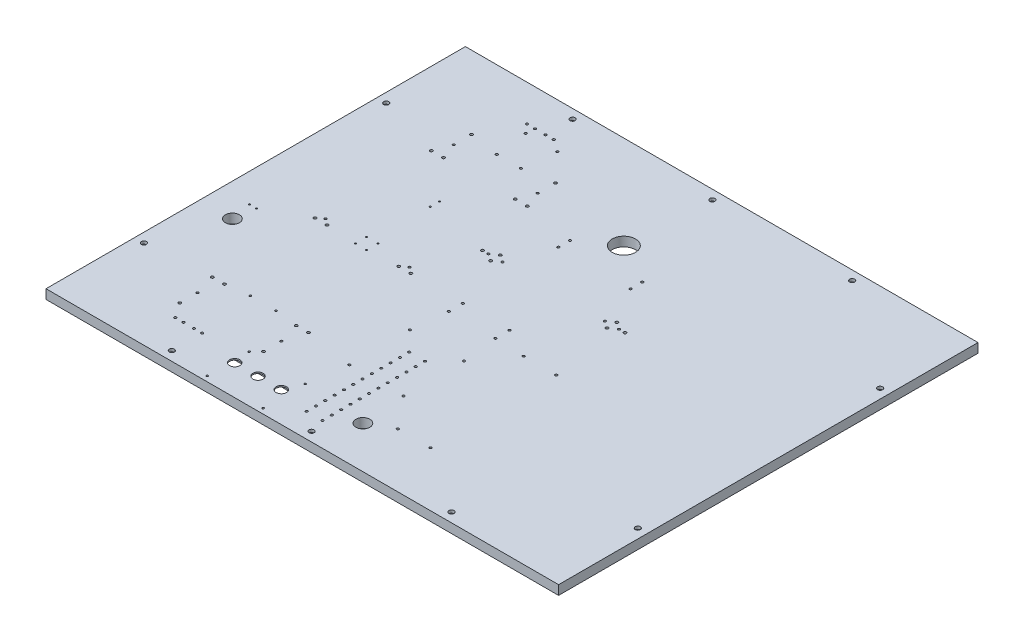
from build123d import *

# Parameters (mm, degrees)
SKETCH_1_W                   = 1100
SKETCH_1_H                   = 900
EXTRUDE_1_DEPTH              = 20
HOLE_WIZARD_M6_1_D           = 7
HOLE_WIZARD_M6_1_CBORE_D     = 11
HOLE_WIZARD_M6_1_CBORE_DEPTH = 6
HOLE_WIZARD_M4_1_D           = 3.3
HOLE_WIZARD_M4_1_DEPTH       = 10.1
HOLE_WIZARD_M4_1_TIP         = 0.991420021
HOLE_WIZARD_M4_2_D           = 3.3
HOLE_WIZARD_M4_2_DEPTH       = 10.1
HOLE_WIZARD_M4_2_TIP         = 0.991420021
SKETCH_8_R                   = 11
CUT_EXTRUDE_1_DEPTH          = 1422.407752899
SKETCH_9_W                   = 160
SKETCH_9_H                   = 50
CUT_EXTRUDE_2_DEPTH          = 17
FILLET_1_R                   = 8
HOLE_WIZARD_M6_1_2_D         = 5
HOLE_WIZARD_M6_1_2_DEPTH     = 15
HOLE_WIZARD_M6_1_2_TIP       = 1.502151548
HOLE_WIZARD_M6_2_D           = 5
HOLE_WIZARD_M6_2_DEPTH       = 15
HOLE_WIZARD_M6_2_TIP         = 1.502151548
HOLE_WIZARD_M6_3_D           = 5
HOLE_WIZARD_M6_3_DEPTH       = 15
HOLE_WIZARD_M6_3_TIP         = 1.502151548
HOLE_WIZARD_M6_4_AT_2_COUNT  = 2
HOLE_WIZARD_M6_4_AT_2_PITCH  = 34
PATTERN_LINEAR_1_COUNT       = 12
PATTERN_LINEAR_1_PITCH       = 20
SKETCH_18_R                  = 25
SKETCH_18_R_2                = 15
CUT_EXTRUDE_3_DEPTH          = 1422.407752899
HOLE_WIZARD_M6_5_D           = 5
HOLE_WIZARD_M6_5_DEPTH       = 15
HOLE_WIZARD_M6_5_TIP         = 1.502151548
SKETCH_21_R                  = 3
CUT_EXTRUDE_4_DEPTH          = 1422.407752899
HOLE_WIZARD_M4_3_D           = 3.3
HOLE_WIZARD_M4_3_DEPTH       = 10.1
HOLE_WIZARD_M4_3_TIP         = 0.991420021
HOLE_WIZARD_M6_6_D           = 5
HOLE_WIZARD_M6_6_DEPTH       = 15
HOLE_WIZARD_M6_6_TIP         = 1.502151548
HOLE_WIZARD_M5_1_D           = 4.2
HOLE_WIZARD_M5_1_DEPTH       = 12.4
HOLE_WIZARD_M5_1_TIP         = 1.2618073
HOLE_WIZARD_M6_7_D           = 5
HOLE_WIZARD_M6_7_DEPTH       = 15
HOLE_WIZARD_M6_7_TIP         = 1.502151548
HOLE_WIZARD_M5_2_D           = 4.2
HOLE_WIZARD_M5_2_DEPTH       = 12.4
HOLE_WIZARD_M5_2_TIP         = 1.2618073
HOLE_WIZARD_M6_8_D           = 5
HOLE_WIZARD_M6_8_DEPTH       = 15
HOLE_WIZARD_M6_8_TIP         = 1.502151548


with BuildPart() as part:
    # 草图1 → 凸台-拉伸1 (new body)
    with BuildSketch(Plane(origin=(0, 0, 0), x_dir=(1, 0, 0), z_dir=(0, 1, 0))):
        with Locations((550, 450)):
            Rectangle(SKETCH_1_W, SKETCH_1_H)
    extrude(amount=-EXTRUDE_1_DEPTH)

    # Hole Wizard M6 _1 (through all)
    with Locations(Plane(origin=(0, 0, 0), x_dir=(-1, 0, 0), z_dir=(0, 1, 0))):
        with Locations((-250, -20), (-550, -20), (-850, -20), (-1080, -190), (-1080, -710), (-850, -880), (-550, -880), (-250, -880), (-20, -710), (-20, -190)):
            CounterBoreHole(HOLE_WIZARD_M6_1_D / 2, HOLE_WIZARD_M6_1_CBORE_D / 2, HOLE_WIZARD_M6_1_CBORE_DEPTH)

    # M4 螺纹孔1
    with Locations(Plane(origin=(0, 0, 0), x_dir=(-1, 0, 0), z_dir=(0, 1, 0))):
        with Locations((-260, -584.5), (-260, -564.5)):
            Hole(HOLE_WIZARD_M4_1_D / 2, depth=HOLE_WIZARD_M4_1_DEPTH)
            with Locations((0, 0, -(HOLE_WIZARD_M4_1_DEPTH + HOLE_WIZARD_M4_1_TIP / 2))):  # 118° drill point
                Cone(0, HOLE_WIZARD_M4_1_D / 2, HOLE_WIZARD_M4_1_TIP, mode=Mode.SUBTRACT)

    # M4 螺纹孔2
    with Locations(Plane(origin=(0, 0, 0), x_dir=(-1, 0, 0), z_dir=(0, 1, 0))):
        with Locations((-272, -440), (-248, -440), (-272, -416), (-248, -416)):
            Hole(HOLE_WIZARD_M4_2_D / 2, depth=HOLE_WIZARD_M4_2_DEPTH)
            with Locations((0, 0, -(HOLE_WIZARD_M4_2_DEPTH + HOLE_WIZARD_M4_2_TIP / 2))):  # 118° drill point
                Cone(0, HOLE_WIZARD_M4_2_D / 2, HOLE_WIZARD_M4_2_TIP, mode=Mode.SUBTRACT)

    # 草图8 → 切除-拉伸1 (cut, through all)
    with BuildSketch(Plane(origin=(0, 0, 0), x_dir=(1, 0, 0), z_dir=(0, 1, 0))):
        with Locations(Location((340, 65, 0), (0, 0, 270))):
            Circle(SKETCH_8_R)
        with Locations(Location((390, 65, 0), (0, 0, 270))):
            Circle(SKETCH_8_R)
        with Locations(Location((440, 65, 0), (0, 0, 270))):
            Circle(SKETCH_8_R)
    extrude(amount=-CUT_EXTRUDE_1_DEPTH, mode=Mode.SUBTRACT)

    # 草图9 → 切除-拉伸2 (cut)
    with BuildSketch(Plane.XZ.offset(20)):
        with Locations((390, -65)):
            Rectangle(SKETCH_9_W, SKETCH_9_H)
    extrude(amount=-CUT_EXTRUDE_2_DEPTH, mode=Mode.SUBTRACT)

    # 圆角1
    fillet_1_edges = [part.edges().sort_by_distance(p)[0] for p in [
        (310, -11.5, -90),
        (310, -11.5, -40),
        (470, -11.5, -40),
        (470, -11.5, -90),
    ]]
    fillet(fillet_1_edges, radius=FILLET_1_R)

    # Hole Wizard M6 _1 2
    with Locations(Plane(origin=(0, 0, 0), x_dir=(-1, 0, 0), z_dir=(0, 1, 0))):
        with Locations((-210, -85), (-250, -85), (-170, -155), (-170, -430), (-170, -705), (-210, -822), (-250, -822), (-350, -155), (-350, -430), (-350, -705), (-472.5, -652), (-472.5, -627), (-440, -539.5), (-410, -539.5), (-690, -539.5), (-660, -539.5), (-627.5, -627), (-627.5, -652)):
            Hole(HOLE_WIZARD_M6_1_2_D / 2, depth=HOLE_WIZARD_M6_1_2_DEPTH)
            with Locations((0, 0, -(HOLE_WIZARD_M6_1_2_DEPTH + HOLE_WIZARD_M6_1_2_TIP / 2))):  # 118° drill point
                Cone(0, HOLE_WIZARD_M6_1_2_D / 2, HOLE_WIZARD_M6_1_2_TIP, mode=Mode.SUBTRACT)

    # M6 螺纹孔2
    with Locations(Plane(origin=(0, 0, 0), x_dir=(-1, 0, 0), z_dir=(0, 1, 0))):
        with Locations((-638, -387), (-638, -117), (-708, -387), (-708, -117)):
            Hole(HOLE_WIZARD_M6_2_D / 2, depth=HOLE_WIZARD_M6_2_DEPTH)
            with Locations((0, 0, -(HOLE_WIZARD_M6_2_DEPTH + HOLE_WIZARD_M6_2_TIP / 2))):  # 118° drill point
                Cone(0, HOLE_WIZARD_M6_2_D / 2, HOLE_WIZARD_M6_2_TIP, mode=Mode.SUBTRACT)

    # M6 螺纹孔3
    with Locations(Plane(origin=(0, 0, 0), x_dir=(-1, 0, 0), z_dir=(0, 1, 0))):
        with Locations((-474.5, -420), (-574.5, -420), (-574.5, -390), (-474.5, -390)):
            Hole(HOLE_WIZARD_M6_3_D / 2, depth=HOLE_WIZARD_M6_3_DEPTH)
            with Locations((0, 0, -(HOLE_WIZARD_M6_3_DEPTH + HOLE_WIZARD_M6_3_TIP / 2))):  # 118° drill point
                Cone(0, HOLE_WIZARD_M6_3_D / 2, HOLE_WIZARD_M6_3_TIP, mode=Mode.SUBTRACT)

    # 草图16 → M6 螺纹孔4 (revolve, cut)
    with BuildSketch(Plane(origin=(507.5, 0, -271.861375126), x_dir=(0, 0, 1), z_dir=(1, 0, 0))):
        Polygon((0, 0), (0, 16.502151548), (2.5, 15), (2.5, 0), align=None)
    hole_wizard_m6_4 = revolve(axis=Axis((507.5, 6.35, -271.861375126), (0, -1, 0)), mode=Mode.SUBTRACT)

    # M6 螺纹孔4 at 2: M6 螺纹孔4 ×2
    with Locations(*[(i * HOLE_WIZARD_M6_4_AT_2_PITCH, 0, 0) for i in range(1, HOLE_WIZARD_M6_4_AT_2_COUNT)]):
        add(hole_wizard_m6_4, mode=Mode.SUBTRACT)

    # 阵列(线性)1: M6 螺纹孔4 ×12
    with Locations(*[(0, 0, i * PATTERN_LINEAR_1_PITCH) for i in range(1, PATTERN_LINEAR_1_COUNT)]):
        add(hole_wizard_m6_4, mode=Mode.SUBTRACT)

    # 阵列(线性)1 copy 1 sketch → 阵列(线性)1 copy 1 (revolve, cut)
    with BuildSketch(Plane(origin=(541.5, 0, -251.861375126), x_dir=(0, 0, 1), z_dir=(1, 0, 0))):
        Polygon((0, 0), (0, 16.502151548), (2.5, 15), (2.5, 0), align=None)
    revolve(axis=Axis((541.5, 6.35, -251.861375126), (0, -1, 0)), mode=Mode.SUBTRACT)

    # 阵列(线性)1 copy 2 sketch → 阵列(线性)1 copy 2 (revolve, cut)
    with BuildSketch(Plane(origin=(541.5, 0, -231.861375126), x_dir=(0, 0, 1), z_dir=(1, 0, 0))):
        Polygon((0, 0), (0, 16.502151548), (2.5, 15), (2.5, 0), align=None)
    revolve(axis=Axis((541.5, 6.35, -231.861375126), (0, -1, 0)), mode=Mode.SUBTRACT)

    # 阵列(线性)1 copy 3 sketch → 阵列(线性)1 copy 3 (revolve, cut)
    with BuildSketch(Plane(origin=(541.5, 0, -211.861375126), x_dir=(0, 0, 1), z_dir=(1, 0, 0))):
        Polygon((0, 0), (0, 16.502151548), (2.5, 15), (2.5, 0), align=None)
    revolve(axis=Axis((541.5, 6.35, -211.861375126), (0, -1, 0)), mode=Mode.SUBTRACT)

    # 阵列(线性)1 copy 4 sketch → 阵列(线性)1 copy 4 (revolve, cut)
    with BuildSketch(Plane(origin=(541.5, 0, -191.861375126), x_dir=(0, 0, 1), z_dir=(1, 0, 0))):
        Polygon((0, 0), (0, 16.502151548), (2.5, 15), (2.5, 0), align=None)
    revolve(axis=Axis((541.5, 6.35, -191.861375126), (0, -1, 0)), mode=Mode.SUBTRACT)

    # 阵列(线性)1 copy 5 sketch → 阵列(线性)1 copy 5 (revolve, cut)
    with BuildSketch(Plane(origin=(541.5, 0, -171.861375126), x_dir=(0, 0, 1), z_dir=(1, 0, 0))):
        Polygon((0, 0), (0, 16.502151548), (2.5, 15), (2.5, 0), align=None)
    revolve(axis=Axis((541.5, 6.35, -171.861375126), (0, -1, 0)), mode=Mode.SUBTRACT)

    # 阵列(线性)1 copy 6 sketch → 阵列(线性)1 copy 6 (revolve, cut)
    with BuildSketch(Plane(origin=(541.5, 0, -151.861375126), x_dir=(0, 0, 1), z_dir=(1, 0, 0))):
        Polygon((0, 0), (0, 16.502151548), (2.5, 15), (2.5, 0), align=None)
    revolve(axis=Axis((541.5, 6.35, -151.861375126), (0, -1, 0)), mode=Mode.SUBTRACT)

    # 阵列(线性)1 copy 7 sketch → 阵列(线性)1 copy 7 (revolve, cut)
    with BuildSketch(Plane(origin=(541.5, 0, -131.861375126), x_dir=(0, 0, 1), z_dir=(1, 0, 0))):
        Polygon((0, 0), (0, 16.502151548), (2.5, 15), (2.5, 0), align=None)
    revolve(axis=Axis((541.5, 6.35, -131.861375126), (0, -1, 0)), mode=Mode.SUBTRACT)

    # 阵列(线性)1 copy 8 sketch → 阵列(线性)1 copy 8 (revolve, cut)
    with BuildSketch(Plane(origin=(541.5, 0, -111.861375126), x_dir=(0, 0, 1), z_dir=(1, 0, 0))):
        Polygon((0, 0), (0, 16.502151548), (2.5, 15), (2.5, 0), align=None)
    revolve(axis=Axis((541.5, 6.35, -111.861375126), (0, -1, 0)), mode=Mode.SUBTRACT)

    # 阵列(线性)1 copy 9 sketch → 阵列(线性)1 copy 9 (revolve, cut)
    with BuildSketch(Plane(origin=(541.5, 0, -91.861375126), x_dir=(0, 0, 1), z_dir=(1, 0, 0))):
        Polygon((0, 0), (0, 16.502151548), (2.5, 15), (2.5, 0), align=None)
    revolve(axis=Axis((541.5, 6.35, -91.861375126), (0, -1, 0)), mode=Mode.SUBTRACT)

    # 阵列(线性)1 copy 10 sketch → 阵列(线性)1 copy 10 (revolve, cut)
    with BuildSketch(Plane(origin=(541.5, 0, -71.861375126), x_dir=(0, 0, 1), z_dir=(1, 0, 0))):
        Polygon((0, 0), (0, 16.502151548), (2.5, 15), (2.5, 0), align=None)
    revolve(axis=Axis((541.5, 6.35, -71.861375126), (0, -1, 0)), mode=Mode.SUBTRACT)

    # 阵列(线性)1 copy 11 sketch → 阵列(线性)1 copy 11 (revolve, cut)
    with BuildSketch(Plane(origin=(541.5, 0, -51.861375126), x_dir=(0, 0, 1), z_dir=(1, 0, 0))):
        Polygon((0, 0), (0, 16.502151548), (2.5, 15), (2.5, 0), align=None)
    revolve(axis=Axis((541.5, 6.35, -51.861375126), (0, -1, 0)), mode=Mode.SUBTRACT)

    # 草图18 → 切除-拉伸3 (cut, through all)
    with BuildSketch(Plane(origin=(0, 0, 0), x_dir=(1, 0, 0), z_dir=(0, 1, 0))):
        with Locations(Location((540, 700, 0), (0, 0, 270))):
            Circle(SKETCH_18_R)
        with Locations(Location((70, 330, 0), (0, 0, 270))):
            Circle(SKETCH_18_R_2)
        with Locations(Location((590, 90, 0), (0, 0, 270))):
            Circle(SKETCH_18_R_2)
    extrude(amount=-CUT_EXTRUDE_3_DEPTH, mode=Mode.SUBTRACT)

    # M6 螺纹孔5
    with Locations(Plane(origin=(0, 0, 0), x_dir=(-1, 0, 0), z_dir=(0, 1, 0))):
        with Locations((-467, -314), (-467, -184), (-583, -184), (-583, -314)):
            Hole(HOLE_WIZARD_M6_5_D / 2, depth=HOLE_WIZARD_M6_5_DEPTH)
            with Locations((0, 0, -(HOLE_WIZARD_M6_5_DEPTH + HOLE_WIZARD_M6_5_TIP / 2))):  # 118° drill point
                Cone(0, HOLE_WIZARD_M6_5_D / 2, HOLE_WIZARD_M6_5_TIP, mode=Mode.SUBTRACT)

    # 草图21 → 切除-拉伸4 (cut, through all)
    with BuildSketch(Plane(origin=(0, 0, 0), x_dir=(1, 0, 0), z_dir=(0, 1, 0))):
        with Locations(Location((170, 117, 0), (0, 0, 270))):
            Circle(SKETCH_21_R)
        with Locations(Location((350, 117, 0), (0, 0, 270))):
            Circle(SKETCH_21_R)
        with Locations(Location((157, 200, 0), (0, 0, 270))):
            Circle(SKETCH_21_R)
        with Locations(Location((183, 200, 0), (0, 0, 270))):
            Circle(SKETCH_21_R)
        with Locations(Location((337, 200, 0), (0, 0, 270))):
            Circle(SKETCH_21_R)
        with Locations(Location((363, 200, 0), (0, 0, 270))):
            Circle(SKETCH_21_R)
        with Locations(Location((157, 420, 0), (0, 0, 270))):
            Circle(SKETCH_21_R)
        with Locations(Location((183, 420, 0), (0, 0, 270))):
            Circle(SKETCH_21_R)
        with Locations(Location((337, 420, 0), (0, 0, 270))):
            Circle(SKETCH_21_R)
        with Locations(Location((363, 420, 0), (0, 0, 270))):
            Circle(SKETCH_21_R)
        with Locations(Location((157, 670, 0), (0, 0, 270))):
            Circle(SKETCH_21_R)
        with Locations(Location((183, 670, 0), (0, 0, 270))):
            Circle(SKETCH_21_R)
        with Locations(Location((337, 670, 0), (0, 0, 270))):
            Circle(SKETCH_21_R)
        with Locations(Location((363, 670, 0), (0, 0, 270))):
            Circle(SKETCH_21_R)
        with Locations(Location((170, 743, 0), (0, 0, 270))):
            Circle(SKETCH_21_R)
        with Locations(Location((350, 743, 0), (0, 0, 270))):
            Circle(SKETCH_21_R)
        with Locations(Location((397, 539.5, 0), (0, 0, 270))):
            Circle(SKETCH_21_R)
        with Locations(Location((425, 529, 0), (0, 0, 270))):
            Circle(SKETCH_21_R)
        with Locations(Location((675, 529, 0), (0, 0, 270))):
            Circle(SKETCH_21_R)
        with Locations(Location((425, 550, 0), (0, 0, 270))):
            Circle(SKETCH_21_R)
        with Locations(Location((675, 550, 0), (0, 0, 270))):
            Circle(SKETCH_21_R)
        with Locations(Location((703, 539.5, 0), (0, 0, 270))):
            Circle(SKETCH_21_R)
    extrude(amount=-CUT_EXTRUDE_4_DEPTH, mode=Mode.SUBTRACT)

    # M4 螺纹孔3
    with Locations(Plane(origin=(0, 0, 0), x_dir=(-1, 0, 0), z_dir=(0, 1, 0))):
        with Locations((-61.5, -375), (-76.5, -375)):
            Hole(HOLE_WIZARD_M4_3_D / 2, depth=HOLE_WIZARD_M4_3_DEPTH)
            with Locations((0, 0, -(HOLE_WIZARD_M4_3_DEPTH + HOLE_WIZARD_M4_3_TIP / 2))):  # 118° drill point
                Cone(0, HOLE_WIZARD_M4_3_D / 2, HOLE_WIZARD_M4_3_TIP, mode=Mode.SUBTRACT)

    # M6 螺纹孔6
    with Locations(Plane(origin=(0, 0, 0), x_dir=(-1, 0, 0), z_dir=(0, 1, 0))):
        with Locations((-192.5, -85), (-232.5, -85)):
            Hole(HOLE_WIZARD_M6_6_D / 2, depth=HOLE_WIZARD_M6_6_DEPTH)
            with Locations((0, 0, -(HOLE_WIZARD_M6_6_DEPTH + HOLE_WIZARD_M6_6_TIP / 2))):  # 118° drill point
                Cone(0, HOLE_WIZARD_M6_6_D / 2, HOLE_WIZARD_M6_6_TIP, mode=Mode.SUBTRACT)

    # M5 螺纹孔1
    with Locations(Plane(origin=(0, 0, 0), x_dir=(-1, 0, 0), z_dir=(0, 1, 0))):
        with Locations((-335, -11), (-455, -11), (-455, -101), (-335, -101)):
            Hole(HOLE_WIZARD_M5_1_D / 2, depth=HOLE_WIZARD_M5_1_DEPTH)
            with Locations((0, 0, -(HOLE_WIZARD_M5_1_DEPTH + HOLE_WIZARD_M5_1_TIP / 2))):  # 118° drill point
                Cone(0, HOLE_WIZARD_M5_1_D / 2, HOLE_WIZARD_M5_1_TIP, mode=Mode.SUBTRACT)

    # M6 螺纹孔7
    with Locations(Plane(origin=(0, 0, 0), x_dir=(-1, 0, 0), z_dir=(0, 1, 0))):
        with Locations((-267.5, -822), (-227.5, -822)):
            Hole(HOLE_WIZARD_M6_7_D / 2, depth=HOLE_WIZARD_M6_7_DEPTH)
            with Locations((0, 0, -(HOLE_WIZARD_M6_7_DEPTH + HOLE_WIZARD_M6_7_TIP / 2))):  # 118° drill point
                Cone(0, HOLE_WIZARD_M6_7_D / 2, HOLE_WIZARD_M6_7_TIP, mode=Mode.SUBTRACT)

    # M5 螺纹孔2
    with Locations(Plane(origin=(0, 0, 0), x_dir=(-1, 0, 0), z_dir=(0, 1, 0))):
        with Locations((-232.5, -206), (-287.5, -206)):
            Hole(HOLE_WIZARD_M5_2_D / 2, depth=HOLE_WIZARD_M5_2_DEPTH)
            with Locations((0, 0, -(HOLE_WIZARD_M5_2_DEPTH + HOLE_WIZARD_M5_2_TIP / 2))):  # 118° drill point
                Cone(0, HOLE_WIZARD_M5_2_D / 2, HOLE_WIZARD_M5_2_TIP, mode=Mode.SUBTRACT)

    # M6 螺纹孔8
    with Locations(Plane(origin=(0, 0, 0), x_dir=(-1, 0, 0), z_dir=(0, 1, 0))):
        with Locations((-226, -803.3), (-234, -733.3), (-286, -733.3), (-294, -803.3)):
            Hole(HOLE_WIZARD_M6_8_D / 2, depth=HOLE_WIZARD_M6_8_DEPTH)
            with Locations((0, 0, -(HOLE_WIZARD_M6_8_DEPTH + HOLE_WIZARD_M6_8_TIP / 2))):  # 118° drill point
                Cone(0, HOLE_WIZARD_M6_8_D / 2, HOLE_WIZARD_M6_8_TIP, mode=Mode.SUBTRACT)


solid = part.part
